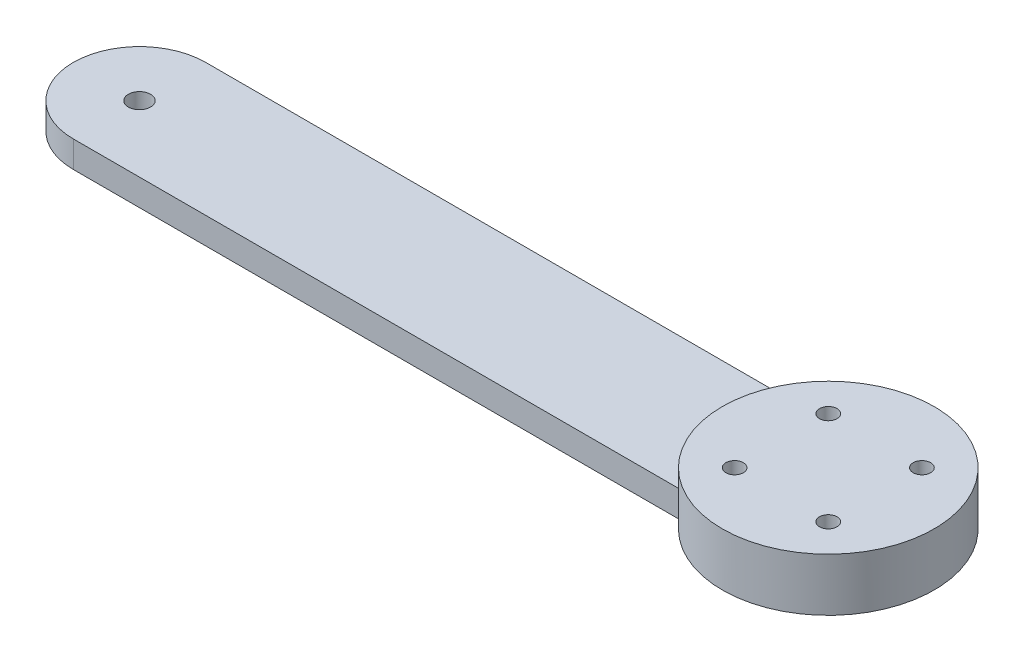
from build123d import *

# Parameters (mm, degrees)
EXTRUDE_1_DEPTH     = 5
SKETCH_7_R          = 20
EXTRUDE_3_DEPTH     = 10
CUT_EXTRUDE_2_REACH = 89.892
SKETCH_8_R          = 1.65
CUT_EXTRUDE_3_REACH = 89.464
SKETCH_9_R          = 2.1


with BuildPart() as part:
    # 草图1 → 凸台-拉伸1 (new body)
    with BuildSketch(Plane(origin=(0, 0, 0), x_dir=(1, 0, 0), z_dir=(0, 1, 0))):
        with BuildLine():
            Line((-65, 12.5), (65, 12.5))
            ThreePointArc((65, 12.5), (77.5, 0), (65, -12.5))
            Line((65, -12.5), (-65, -12.5))
            ThreePointArc((-65, -12.5), (-77.5, 0), (-65, 12.5))
        make_face()
    extrude(amount=EXTRUDE_1_DEPTH)

    # 草图7 → 凸台-拉伸3 (add)
    with BuildSketch(Plane(origin=(0, 0, 0), x_dir=(1, 0, 0), z_dir=(0, 1, 0))):
        with Locations(Location((65, 0, 0), (0, 0, 141.317812547))):
            Circle(SKETCH_7_R)
    extrude(amount=EXTRUDE_3_DEPTH)

    # 草图8 → 切除-拉伸2 (cut, up to next)
    with BuildSketch(Plane(origin=(0, 10, 0), x_dir=(1, 0, 0), z_dir=(0, 1, 0)), mode=Mode.PRIVATE) as cut_extrude_2_sk1:
        with Locations(Location((56.161165235, 8.838834765, 0), (0, 0, 270))):
            Circle(SKETCH_8_R)
    cut_extrude_2_tool1 = extrude(cut_extrude_2_sk1.sketch, amount=-CUT_EXTRUDE_2_REACH, mode=Mode.PRIVATE) & part.part
    # 草图8 → 切除-拉伸2 (cut, up to next)
    with BuildSketch(Plane(origin=(0, 10, 0), x_dir=(1, 0, 0), z_dir=(0, 1, 0)), mode=Mode.PRIVATE) as cut_extrude_2_sk2:
        with Locations(Location((73.838834765, 8.838834765, 0), (0, 0, 270))):
            Circle(SKETCH_8_R)
    cut_extrude_2_tool2 = extrude(cut_extrude_2_sk2.sketch, amount=-CUT_EXTRUDE_2_REACH, mode=Mode.PRIVATE) & part.part
    # 草图8 → 切除-拉伸2 (cut, up to next)
    with BuildSketch(Plane(origin=(0, 10, 0), x_dir=(1, 0, 0), z_dir=(0, 1, 0)), mode=Mode.PRIVATE) as cut_extrude_2_sk3:
        with Locations(Location((73.838834765, -8.838834765, 0), (0, 0, 270))):
            Circle(SKETCH_8_R)
    cut_extrude_2_tool3 = extrude(cut_extrude_2_sk3.sketch, amount=-CUT_EXTRUDE_2_REACH, mode=Mode.PRIVATE) & part.part
    # 草图8 → 切除-拉伸2 (cut, up to next)
    with BuildSketch(Plane(origin=(0, 10, 0), x_dir=(1, 0, 0), z_dir=(0, 1, 0)), mode=Mode.PRIVATE) as cut_extrude_2_sk4:
        with Locations(Location((56.161165235, -8.838834765, 0), (0, 0, 270))):
            Circle(SKETCH_8_R)
    cut_extrude_2_tool4 = extrude(cut_extrude_2_sk4.sketch, amount=-CUT_EXTRUDE_2_REACH, mode=Mode.PRIVATE) & part.part
    add(cut_extrude_2_tool1.solids().sort_by_distance((56.161165, 10, -8.838835))[0], mode=Mode.SUBTRACT)
    add(cut_extrude_2_tool2.solids().sort_by_distance((73.838835, 10, -8.838835))[0], mode=Mode.SUBTRACT)
    add(cut_extrude_2_tool3.solids().sort_by_distance((73.838835, 10, 8.838835))[0], mode=Mode.SUBTRACT)
    add(cut_extrude_2_tool4.solids().sort_by_distance((56.161165, 10, 8.838835))[0], mode=Mode.SUBTRACT)

    # 草图9 → 切除-拉伸3 (cut, up to next)
    with BuildSketch(Plane(origin=(0, 5, 0), x_dir=(1, 0, 0), z_dir=(0, 1, 0)), mode=Mode.PRIVATE) as cut_extrude_3_sk1:
        with Locations(Location((-65, 0, 0), (0, 0, 270))):
            Circle(SKETCH_9_R)
    cut_extrude_3_tool1 = extrude(cut_extrude_3_sk1.sketch, amount=-CUT_EXTRUDE_3_REACH, mode=Mode.PRIVATE) & part.part
    add(cut_extrude_3_tool1.solids().sort_by_distance((-65, 5, 0))[0], mode=Mode.SUBTRACT)


solid = part.part
